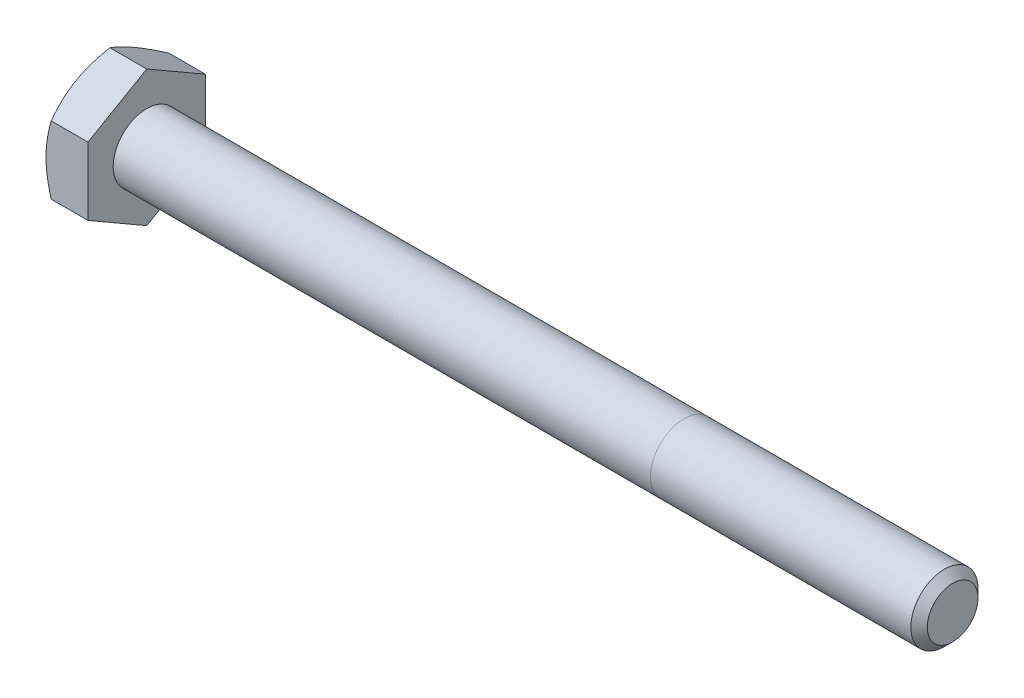
from build123d import *

# Parameters (mm, degrees)
SKETCH5_R           = 3.175
BOSS_EXTRUDE3_DEPTH = 76.2
CHAMFER1_SIZE       = 0.77724
BOSS_EXTRUDE4_DEPTH = 3.96875
SKETCH8_OUTSIDE_W   = 312.23
SKETCH8_OUTSIDE_H   = 313.95
SKETCH8_OUTSIDE_R   = 5.55625
CUT_EXTRUDE3_DEPTH  = 81.616765891
CUT_EXTRUDE3_DRAFT  = -60
CUT_EXTRUDE4_DEPTH  = 0.254
CIRPATTERN1_COUNT   = 3


with BuildPart() as part:
    # Sketch5 → Boss-Extrude3 (new body)
    with BuildSketch(Plane(origin=(40.084375, 0, 0), x_dir=(0, 0, -1), z_dir=(1, 0, 0))):
        Circle(SKETCH5_R)
    extrude(amount=-BOSS_EXTRUDE3_DEPTH)

    # Chamfer1
    chamfer1_edges = [part.edges().sort_by_distance(p)[0] for p in [
        (40.084375, 0, 3.175),
    ]]
    chamfer(chamfer1_edges, length=CHAMFER1_SIZE)

    # Sketch6 → Boss-Extrude4 (add)
    with BuildSketch(Plane.ZY.offset(36.115625)):
        Polygon((5.55625, 3.207902433), (0, 6.415804866), (-5.55625, 3.207902433), (-5.55625, -3.207902433), (0, -6.415804866), (5.55625, -3.207902433), align=None)
    extrude(amount=BOSS_EXTRUDE4_DEPTH)


with BuildPart() as cut_extrude3_tool:
    # Sketch8 outside → Cut-Extrude3 (with draft: the straight prism first)
    with BuildSketch(Plane.ZY.offset(40.084375)):
        Rectangle(SKETCH8_OUTSIDE_W, SKETCH8_OUTSIDE_H)
        Circle(SKETCH8_OUTSIDE_R, mode=Mode.SUBTRACT)
    extrude(amount=-CUT_EXTRUDE3_DEPTH)
    # Cut-Extrude3: the draft: its side faces are tilted about the plane it starts from
    cut_extrude3_sides = [cut_extrude3_tool.faces().sort_by_distance(p)[0] for p in [
        (0.724007945, -156.975, 0),
        (0.724007945, 0, 156.115),
        (0.724007945, 156.975, 0),
        (0.724007945, 0, -156.115),
        (0.724007945, 0, -5.55625),
    ]]
    draft(cut_extrude3_sides, Plane.ZY.offset(40.084375), CUT_EXTRUDE3_DRAFT)


with BuildPart() as part_1:
    add(part.part)

    # Cut-Extrude3: cut by cut_extrude3_tool
    add(cut_extrude3_tool.part, mode=Mode.SUBTRACT)

    # Sketch12 → Cut-Extrude4 (cut)
    with BuildSketch(Plane.ZY.offset(40.084375)):
        with BuildLine():
            Line((0.1666875, 4.2783125), (0.1666875, 2.3891875))
            ThreePointArc((0.1666875, 2.3891875), (0, 2.2225), (-0.1666875, 2.3891875))
            Line((-0.1666875, 2.3891875), (-0.1666875, 4.2783125))
            ThreePointArc((-0.1666875, 4.2783125), (0, 4.445), (0.1666875, 4.2783125))
        make_face()
    cut_extrude4 = extrude(amount=-CUT_EXTRUDE4_DEPTH, mode=Mode.SUBTRACT)

    # CirPattern1: Cut-Extrude4 ×3 about axis
    cirpattern1_axis = Axis((0, 0, 0), (1, 0, 0))
    for i in range(1, CIRPATTERN1_COUNT):
        add(cut_extrude4.rotate(cirpattern1_axis, i * 360 / CIRPATTERN1_COUNT), mode=Mode.SUBTRACT)


solid = part_1.part
